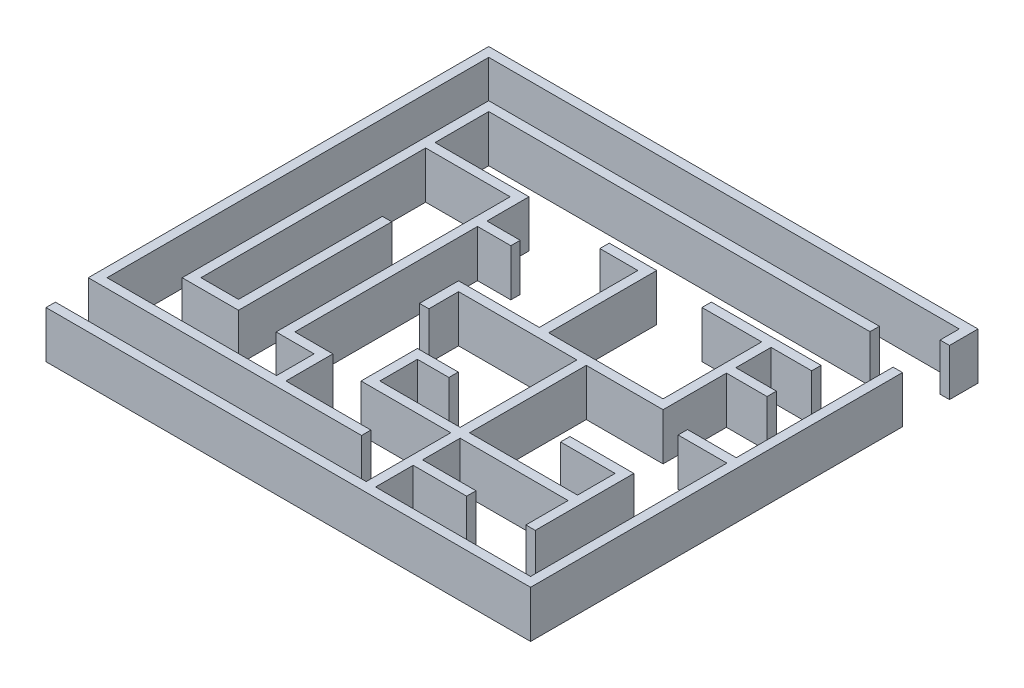
from build123d import *

# Parameters (mm, degrees)
BOSS_EXTRUDE1_DEPTH = 508
BOSS_EXTRUDE2_DEPTH = 508


with BuildPart() as part:
    # Sketch1 → Boss-Extrude1 (new body)
    with BuildSketch(Plane(origin=(0, 0, 0), x_dir=(1, 0, 0), z_dir=(0, 1, 0))):
        Polygon((-2407.2669152, -1690.1194544), (2835.0390848, -1690.1194544), (2835.0390848, 2333.7485456), (2733.4390848, 2333.7485456), (2733.4390848, 636.7745456), (2205.9623648, 636.7745456), (2205.9623648, 535.1745456), (2733.4390848, 535.1745456), (2733.4390848, -1588.5194544), (1057.0390848, -1588.5194544), (1057.0390848, -1182.1194544), (1635.3970848, -1182.1194544), (1635.3970848, -1080.5194544), (1057.0390848, -1080.5194544), (1057.0390848, -674.1194544), (2225.4390848, -674.1194544), (2225.4390848, -1131.3194544), (2327.0390848, -1131.3194544), (2327.0390848, -64.5194544), (1635.3970848, -64.5194544), (1635.3970848, -166.1194544), (2225.4390848, -166.1194544), (2225.4390848, -572.5194544), (1057.0390848, -572.5194544), (1057.0390848, 690.3685456), (1887.8730848, 690.3685456), (1887.8730848, 1376.1685456), (2327.0390848, 1376.1685456), (2327.0390848, 1477.7685456), (1887.8730848, 1477.7685456), (1887.8730848, 1858.7685456), (2327.0390848, 1858.7685456), (2327.0390848, 1960.3685456), (1140.6050848, 1960.1145456), (1140.6050848, 1858.7685456), (1786.2730848, 1858.7685456), (1786.2730848, 791.9685456), (549.0390848, 791.9685456), (549.0390848, 1960.1145456), (35.9590848, 1960.1145456), (35.9590848, 1858.5145456), (447.4390848, 1858.5145456), (447.4390848, 791.9685456), (-426.0669152, 791.9685456), (-426.0669152, 369.0585456), (-324.4669152, 369.0585456), (-324.4669152, 690.3685456), (955.4390848, 690.3685456), (955.4390848, -572.5194544), (86.7590848, -572.5194544), (86.7590848, -166.1194544), (427.3730848, -166.1194544), (427.3730848, -64.5194544), (-14.8409152, -64.5194544), (-14.8409152, -674.1194544), (955.4390848, -674.1194544), (955.4390848, -1588.5194544), (-2407.2669152, -1588.5194544), align=None)
    extrude(amount=BOSS_EXTRUDE1_DEPTH)


with BuildPart() as body_2:
    # Sketch1<3> → Boss-Extrude2 (new body)
    with BuildSketch(Plane(origin=(0, 0, 0), x_dir=(1, 0, 0), z_dir=(0, 1, 0))):
        Polygon((498.2390848, -1182.1194544), (-2458.0669152, -1182.1194544), (-2458.0669152, 3150.3585456), (2835.0390848, 3150.3585456), (2835.0390848, 2841.7485456), (2733.4390848, 2841.7485456), (2733.4390848, 3048.7585456), (-2356.4669152, 3048.7585456), (-2356.4669152, -1080.5194544), (-522.8409152, -1080.5194544), (-522.8409152, -674.1194544), (-934.0669152, -674.1194544), (-934.0669152, 1454.4005456), (-934.0669152, 1858.5145456), (-1848.4669152, 1858.5145456), (-1848.4669152, -572.5194544), (-1442.0669152, -572.5194544), (-1442.0669152, 983.9925456), (-1340.4669152, 983.9925456), (-1340.4669152, -674.1194544), (-1950.0669152, -674.1194544), (-1950.0669152, 2642.3585456), (2276.2390848, 2642.3585456), (2276.2390848, 2540.7585456), (-1848.4669152, 2540.7585456), (-1848.4669152, 1960.1145456), (-832.4669152, 1960.1145456), (-832.4669152, 1505.2005456), (-472.0409152, 1505.2005456), (-472.0409152, 1403.6005456), (-832.4669152, 1403.6005456), (-832.4669152, -572.5194544), (-421.2409152, -572.5194544), (-421.2409152, -1080.5194544), (498.2390848, -1080.5194544), align=None)
    extrude(amount=BOSS_EXTRUDE2_DEPTH)


solid = Compound([part.part, body_2.part])
